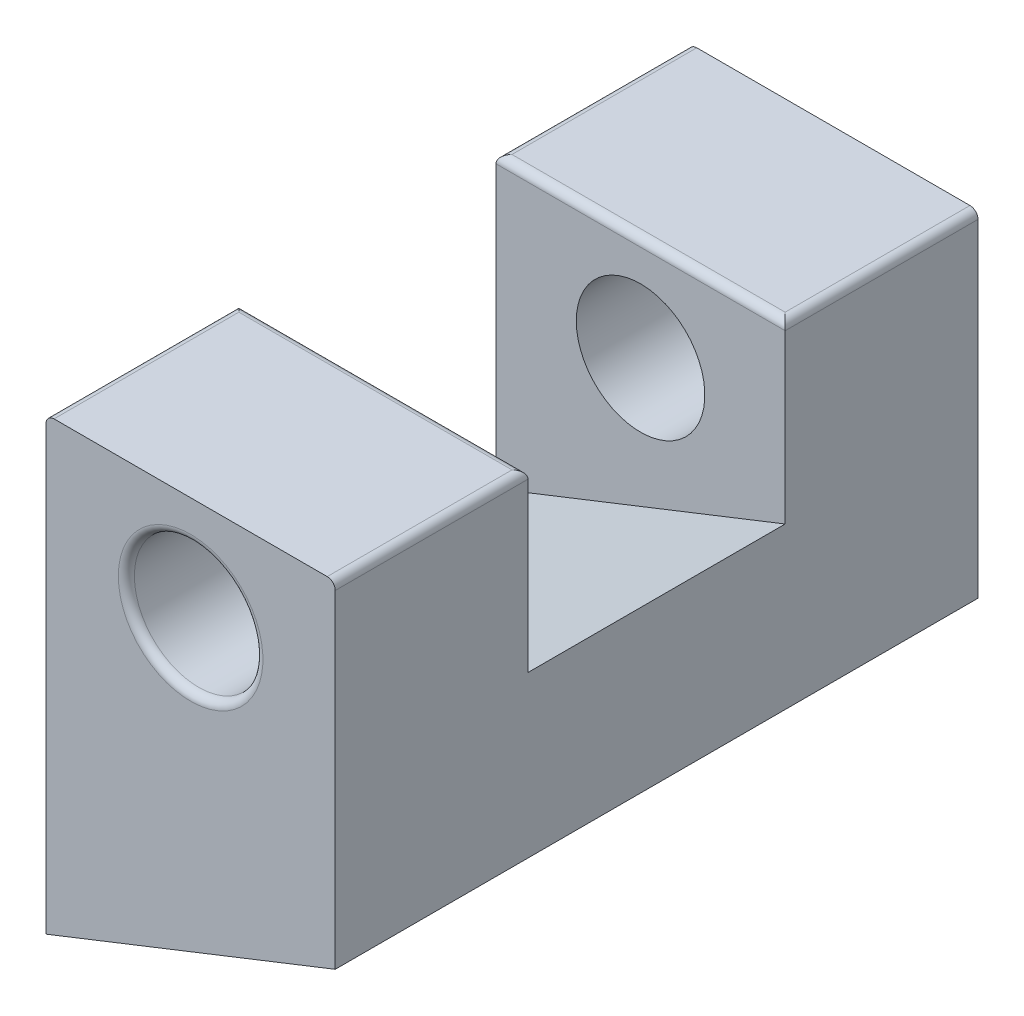
from build123d import *

# Parameters (mm, degrees)
EXTRUDE_1_DEPTH          = 20
CUT_EXTRUDE_1_DEPTH      = 8
FILLET_1_R               = 0.5
CUT_EXTRUDE_2_DEPTH      = 44.510647444
CUT_EXTRUDE_2_DEPTH_BACK = 44.510647444
SKETCH_5_R               = 4
FILLET_2_R               = 0.5


with BuildPart() as part:
    # 스케치1 → 보스-돌출1 (new, symmetric)
    with BuildSketch(Plane.XY):
        Polygon((0, 0), (18, 0), (18, -20.916), (0, -28.021), align=None)
    extrude(amount=EXTRUDE_1_DEPTH, both=True)

    # 스케치2 → 컷-돌출1 (cut, symmetric)
    with BuildSketch(Plane.XY):
        Polygon((0, -18.021), (18, -10.916), (18, 0), (0, 0), align=None)
    extrude(amount=CUT_EXTRUDE_1_DEPTH, both=True, mode=Mode.SUBTRACT)

    # 필렛1
    fillet_1_edges = [part.edges().sort_by_distance(p)[0] for p in [
        (0, 0, -14),
        (18, 0, -14),
        (9, 0, -8),
        (9, 0, 8),
        (0, 0, 14),
        (18, 0, 14),
    ]]
    fillet(fillet_1_edges, radius=FILLET_1_R)

    # 스케치5 → 컷-돌출2 (cut, two sides: drawn at the far end of the back side and taken through both)
    with BuildSketch(Plane.XY.offset(-8).offset(-CUT_EXTRUDE_2_DEPTH_BACK)):
        with Locations((9, -6.4685)):
            Circle(SKETCH_5_R)
    extrude(amount=CUT_EXTRUDE_2_DEPTH + CUT_EXTRUDE_2_DEPTH_BACK, mode=Mode.SUBTRACT)

    # 필렛2
    fillet_2_edges = [part.edges().sort_by_distance(p)[0] for p in [
        (5, -6.4685, -20),
        (5, -6.4685, 20),
    ]]
    fillet(fillet_2_edges, radius=FILLET_2_R)


solid = part.part
